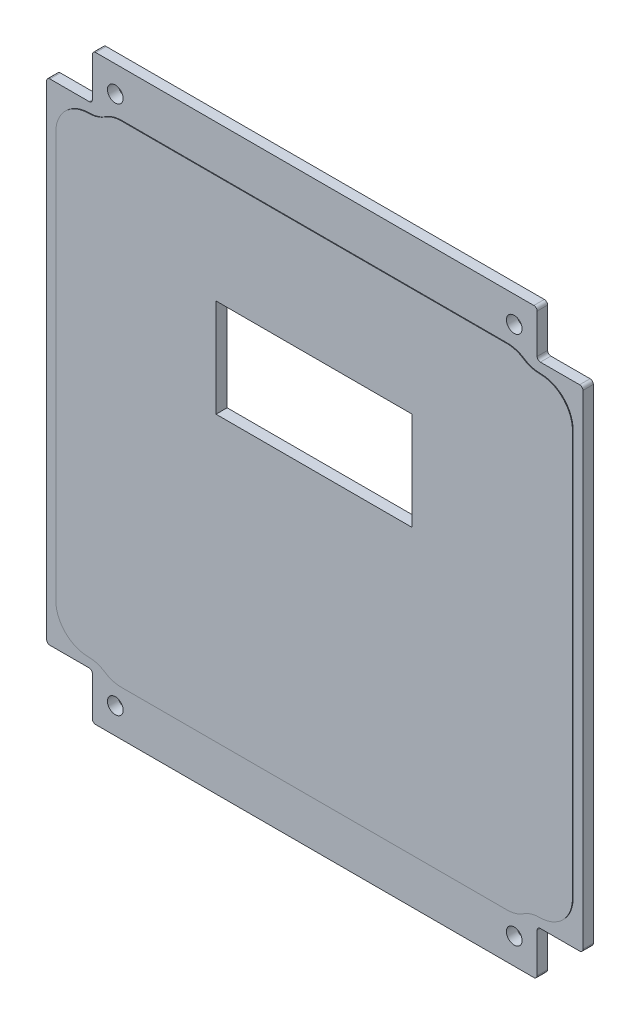
from build123d import *

# Parameters (mm, degrees)
BOSS_EXTRUDE1_DEPTH            = 1.6
BOSS_EXTRUDE2_DEPTH            = 0.1
M2_HOLE1_FIXINGSTRUCTURE_D     = 2.4
M2_HOLE1_FIXINGSTRUCTURE_DEPTH = 200
M2_HOLE1_FIXINGSTRUCTURE_TIP   = 0.721032743
SKETCH4_W                      = 30
SKETCH4_H                      = 15
CUT_EXTRUDE1_DEPTH             = 1.7


with BuildPart() as part:
    # Sketch1 → Boss-Extrude1 (new body)
    with BuildSketch(Plane.XY):
        with BuildLine():
            Line((-34, 44), (-34, 38))
            ThreePointArc((-34, 38), (-34.146446609, 37.646446609), (-34.5, 37.5))
            Line((-34.5, 37.5), (-40.5, 37.5))
            ThreePointArc((-40.5, 37.5), (-40.853553391, 37.353553391), (-41, 37))
            Line((-41, 37), (-41, -37))
            ThreePointArc((-41, -37), (-40.853553391, -37.353553391), (-40.5, -37.5))
            Line((-40.5, -37.5), (-34.5, -37.5))
            ThreePointArc((-34.5, -37.5), (-34.146446609, -37.646446609), (-34, -38))
            Line((-34, -38), (-34, -44))
            ThreePointArc((-34, -44), (-33.853553391, -44.353553391), (-33.5, -44.5))
            Line((-33.5, -44.5), (33.5, -44.5))
            ThreePointArc((33.5, -44.5), (33.853553391, -44.353553391), (34, -44))
            Line((34, -44), (34, -38))
            ThreePointArc((34, -38), (34.146446609, -37.646446609), (34.5, -37.5))
            Line((34.5, -37.5), (40.5, -37.5))
            ThreePointArc((40.5, -37.5), (40.853553391, -37.353553391), (41, -37))
            Line((41, -37), (41, 37))
            ThreePointArc((41, 37), (40.853553391, 37.353553391), (40.5, 37.5))
            Line((40.5, 37.5), (34.5, 37.5))
            ThreePointArc((34.5, 37.5), (34.146446609, 37.646446609), (34, 38))
            Line((34, 38), (34, 44))
            ThreePointArc((34, 44), (33.853553391, 44.353553391), (33.5, 44.5))
            Line((33.5, 44.5), (-33.5, 44.5))
            ThreePointArc((-33.5, 44.5), (-33.853553391, 44.353553391), (-34, 44))
        make_face()
    extrude(amount=BOSS_EXTRUDE1_DEPTH)

    # Esboço1 → Boss-Extrude2 (add)
    with BuildSketch(Plane.XY.offset(1.6)):
        with BuildLine():
            Line((-29.5, -37.5), (29.5, -37.5))
            ThreePointArc((29.5, -37.5), (30.805038314, -37.308461045), (32, -36.75))
            ThreePointArc((32, -36.75), (33.194961686, -36.191538955), (34.5, -36))
            ThreePointArc((34.5, -36), (38.035533906, -34.535533906), (39.5, -31))
            Line((39.5, -31), (39.5, 31))
            ThreePointArc((39.5, 31), (38.035533906, 34.535533906), (34.5, 36))
            ThreePointArc((34.5, 36), (33.194961686, 36.191538955), (32, 36.75))
            ThreePointArc((32, 36.75), (30.805038314, 37.308461045), (29.5, 37.5))
            Line((29.5, 37.5), (-29.5, 37.5))
            ThreePointArc((-29.5, 37.5), (-30.805038314, 37.308461045), (-32, 36.75))
            ThreePointArc((-32, 36.75), (-33.194961686, 36.191538955), (-34.5, 36))
            ThreePointArc((-34.5, 36), (-38.035533906, 34.535533906), (-39.5, 31))
            Line((-39.5, 31), (-39.5, -31))
            ThreePointArc((-39.5, -31), (-38.035533906, -34.535533906), (-34.5, -36))
            ThreePointArc((-34.5, -36), (-33.194961686, -36.191538955), (-32, -36.75))
            ThreePointArc((-32, -36.75), (-30.805038314, -37.308461045), (-29.5, -37.5))
        make_face()
    extrude(amount=BOSS_EXTRUDE2_DEPTH)

    # M2 Hole1-FixingStructure
    with Locations(Plane(origin=(0, 0, 0), x_dir=(-1, 0, 0), z_dir=(0, 0, -1))):
        with Locations((-30.5, 40.5), (30.5, 40.5), (-30.5, -40.5), (30.5, -40.5)):
            Hole(M2_HOLE1_FIXINGSTRUCTURE_D / 2, depth=M2_HOLE1_FIXINGSTRUCTURE_DEPTH)
            with Locations((0, 0, -(M2_HOLE1_FIXINGSTRUCTURE_DEPTH + M2_HOLE1_FIXINGSTRUCTURE_TIP / 2))):  # 118° drill point
                Cone(0, M2_HOLE1_FIXINGSTRUCTURE_D / 2, M2_HOLE1_FIXINGSTRUCTURE_TIP, mode=Mode.SUBTRACT)

    # Sketch4 → Cut-Extrude1 (cut)
    with BuildSketch(Plane(origin=(0, 0, 0), x_dir=(-1, 0, 0), z_dir=(0, 0, -1))):
        with Locations((0, 13.4)):
            Rectangle(SKETCH4_W, SKETCH4_H)
    extrude(amount=-CUT_EXTRUDE1_DEPTH, mode=Mode.SUBTRACT)


solid = part.part
